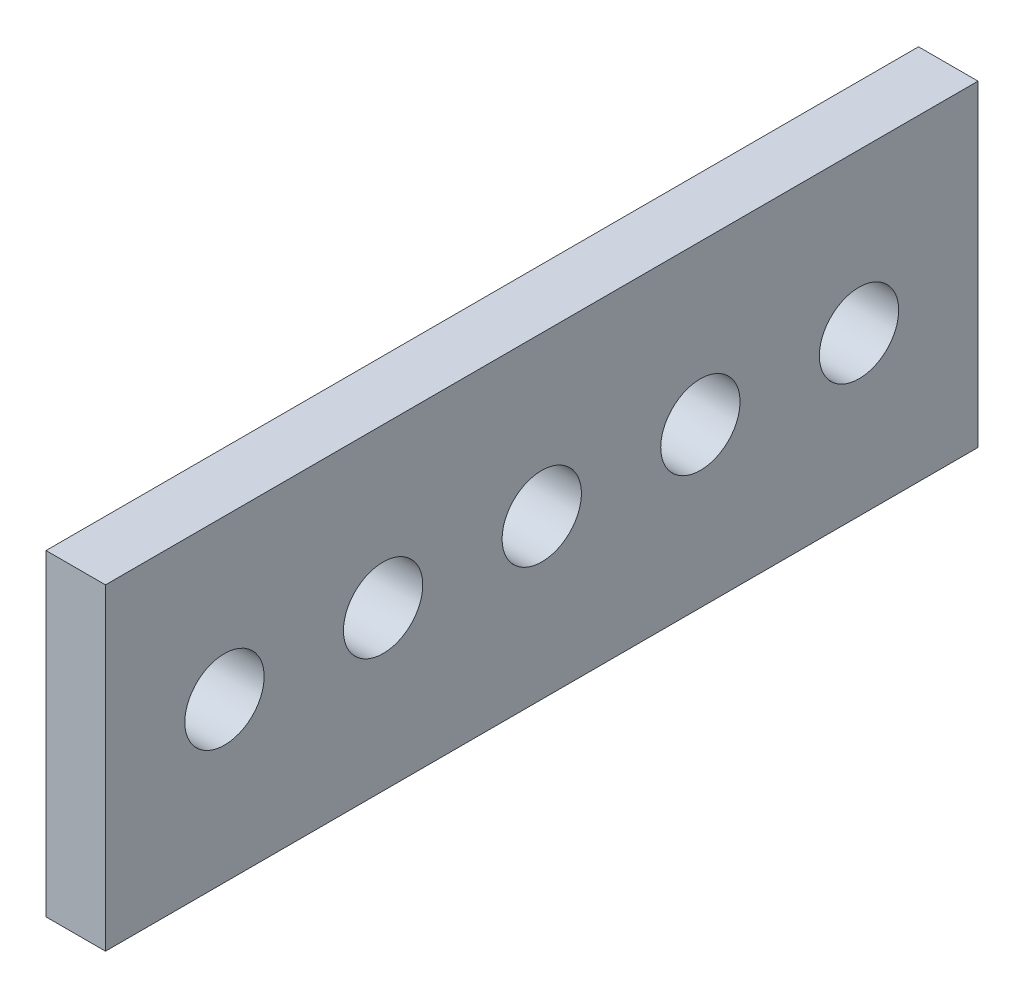
from build123d import *

# Parameters (mm, degrees)
SKETCH1_W           = 69.85
SKETCH1_H           = 25.4
SKETCH1_R           = 3.175
BOSS_EXTRUDE1_DEPTH = 4.7625


with BuildPart() as part:
    # Sketch1 → Boss-Extrude1 (new body)
    with BuildSketch(Plane(origin=(0, 0, 0), x_dir=(0, 0, -1), z_dir=(1, 0, 0))):
        Rectangle(SKETCH1_W, SKETCH1_H)
        with Locations(Location((0, 0, 0), (0, 0, 180))):
            Circle(SKETCH1_R, mode=Mode.SUBTRACT)
        with Locations(Location((-12.7, 0, 0), (0, 0, 180))):
            Circle(SKETCH1_R, mode=Mode.SUBTRACT)
        with Locations(Location((-25.4, 0, 0), (0, 0, 180))):
            Circle(SKETCH1_R, mode=Mode.SUBTRACT)
        with Locations(Location((12.7, 0, 0), (0, 0, 180))):
            Circle(SKETCH1_R, mode=Mode.SUBTRACT)
        with Locations(Location((25.4, 0, 0), (0, 0, 180))):
            Circle(SKETCH1_R, mode=Mode.SUBTRACT)
    extrude(amount=BOSS_EXTRUDE1_DEPTH)


solid = part.part
